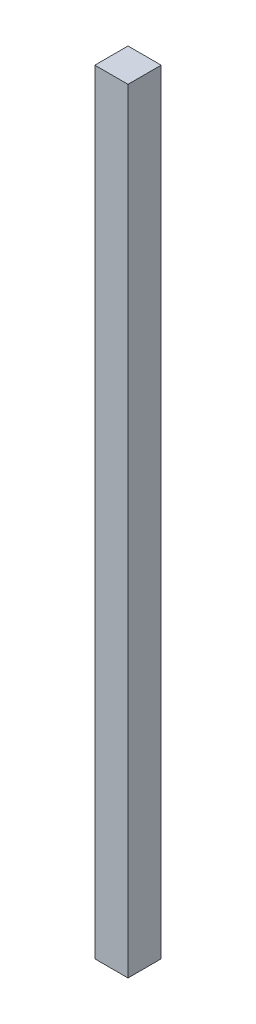
from build123d import *

# Parameters (mm, degrees)
SKETCH1_W           = 38.1
SKETCH1_H           = 38.1
BOSS_EXTRUDE1_DEPTH = 889


with BuildPart() as part:
    # Sketch1 → Boss-Extrude1 (new body)
    with BuildSketch(Plane(origin=(0, 0, 0), x_dir=(1, 0, 0), z_dir=(0, 1, 0))):
        with Locations((19.05, -19.05)):
            Rectangle(SKETCH1_W, SKETCH1_H)
    extrude(amount=BOSS_EXTRUDE1_DEPTH)


solid = part.part
